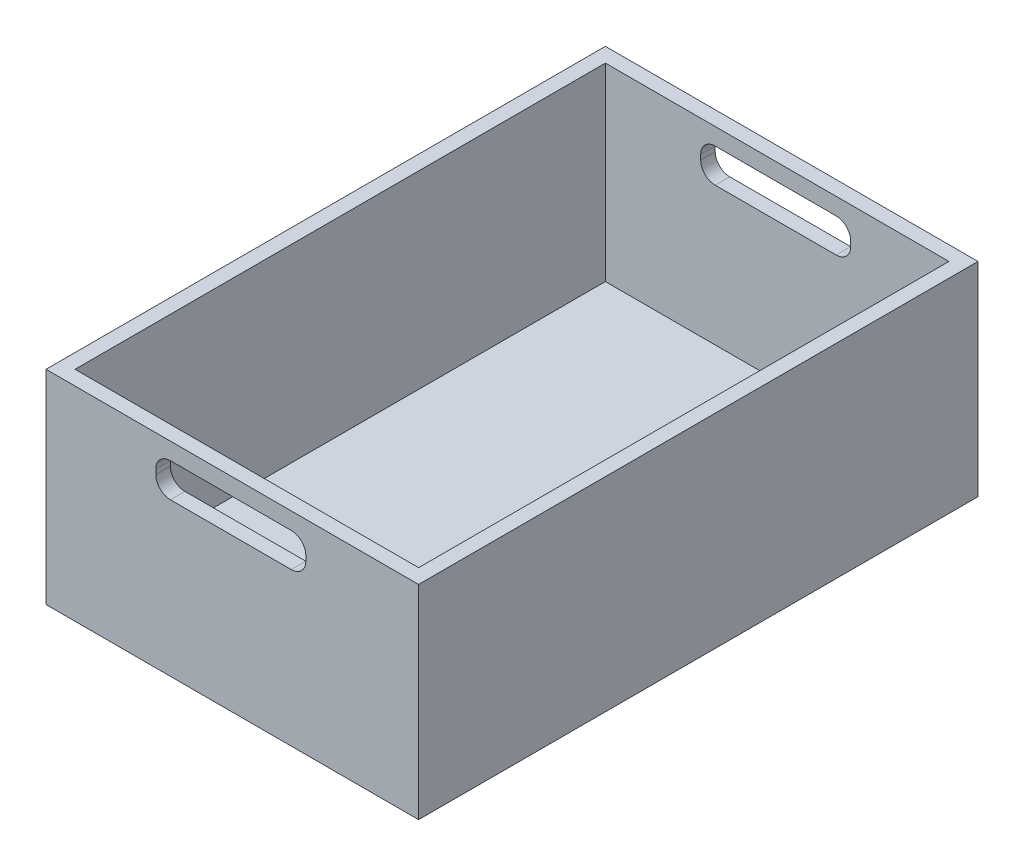
from build123d import *

# Parameters (mm, degrees)
SKETCH1_W               = 385
SKETCH1_H               = 578
BOSS_EXTRUDE1_DEPTH     = 15
SKETCH2_W               = 15
SKETCH2_H               = 578
BOSS_EXTRUDE2_DEPTH     = 195.5
SKETCH3_W               = 355
SKETCH3_H               = 15
BOSS_EXTRUDE3_DEPTH     = 195.5
CUT_EXTRUDE1_DEPTH      = 645.554497308
CUT_EXTRUDE1_DEPTH_BACK = 645.554497308


with BuildPart() as part:
    # Sketch1 → Boss-Extrude1 (new body)
    with BuildSketch(Plane(origin=(0, 0, 0), x_dir=(1, 0, 0), z_dir=(0, 1, 0))):
        Rectangle(SKETCH1_W, SKETCH1_H)
    extrude(amount=BOSS_EXTRUDE1_DEPTH)

    # Sketch2 → Boss-Extrude2 (add)
    with BuildSketch(Plane(origin=(0, 15, 0), x_dir=(1, 0, 0), z_dir=(0, 1, 0))):
        with Locations((185, 0)):
            Rectangle(SKETCH2_W, SKETCH2_H)
    boss_extrude2 = extrude(amount=BOSS_EXTRUDE2_DEPTH)

    # Mirror1: Boss-Extrude2 across plane
    add(boss_extrude2.mirror(Plane(origin=(0, 0, 0), x_dir=(0, 0, 1), z_dir=(1, 0, 0))))

    # Sketch3 → Boss-Extrude3 (add)
    with BuildSketch(Plane(origin=(0, 15, 0), x_dir=(1, 0, 0), z_dir=(0, 1, 0))):
        with Locations((0, -281.5)):
            Rectangle(SKETCH3_W, SKETCH3_H)
    boss_extrude3 = extrude(amount=BOSS_EXTRUDE3_DEPTH)

    # Mirror2: Boss-Extrude3 across plane
    add(boss_extrude3.mirror(Plane.XY))

    # Sketch4 → Cut-Extrude1 (cut, two sides: drawn at the far end of the back side and taken through both)
    with BuildSketch(Plane.XY.offset(289).offset(-CUT_EXTRUDE1_DEPTH_BACK)):
        with BuildLine():
            Line((-64.034446869, 193), (60.965553131, 193))
            ThreePointArc((60.965553131, 193), (71.572154849, 188.606601718), (75.965553131, 178))
            Line((75.965553131, 178), (75.965553131, 173))
            ThreePointArc((75.965553131, 173), (71.572154849, 162.393398282), (60.965553131, 158))
            Line((60.965553131, 158), (-64.034446869, 158))
            ThreePointArc((-64.034446869, 158), (-74.641048586, 162.393398282), (-79.034446869, 173))
            Line((-79.034446869, 173), (-79.034446869, 178))
            ThreePointArc((-79.034446869, 178), (-74.641048586, 188.606601718), (-64.034446869, 193))
        make_face()
    extrude(amount=CUT_EXTRUDE1_DEPTH + CUT_EXTRUDE1_DEPTH_BACK, mode=Mode.SUBTRACT)


solid = part.part
